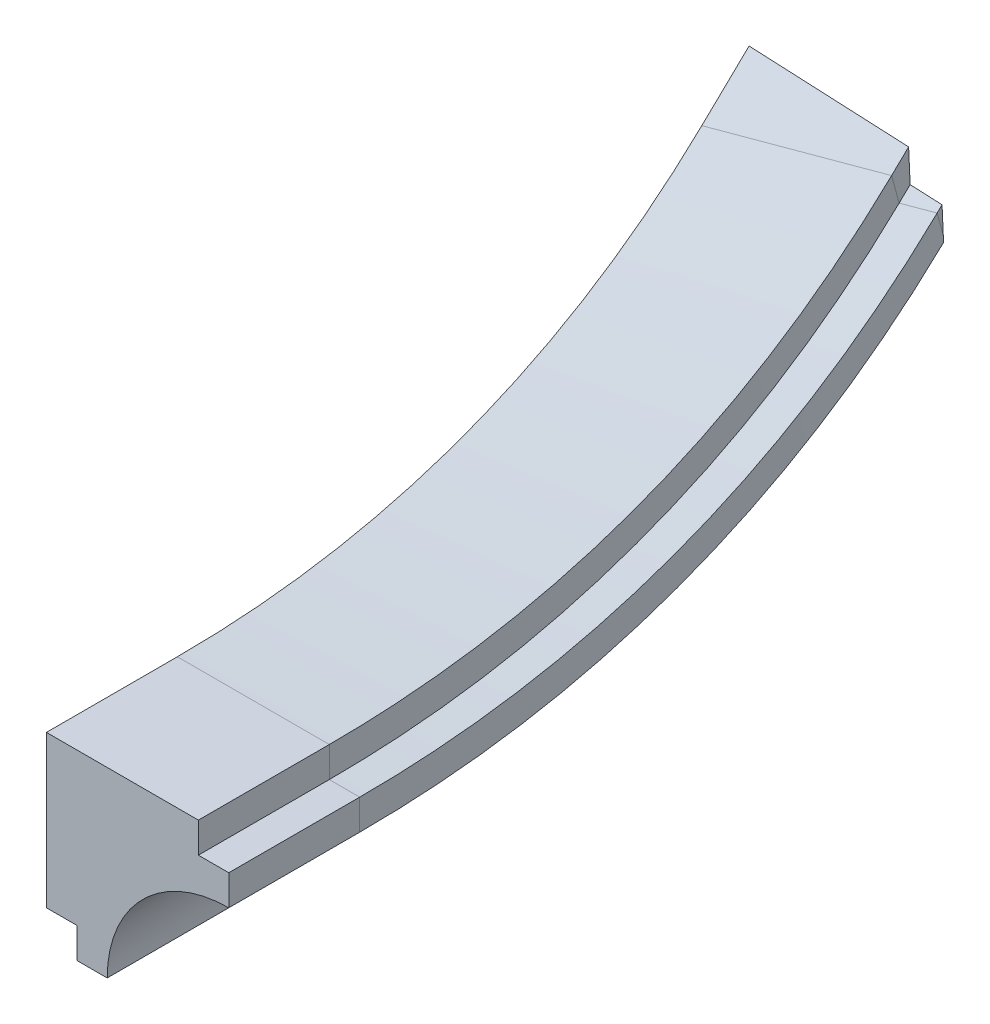
from build123d import *

# Parameters (mm, degrees)
BOSS_EXTRUDE1_DEPTH     = 21.542835
BOSS_EXTRUDE2_DEPTH     = 20
CUT_EXTRUDE1_DEPTH      = 302.548395788
CUT_EXTRUDE1_DEPTH_BACK = 302.548395788


with BuildPart() as part:
    # Sketch2 → Boss-Extrude1 (new body)
    with BuildSketch(Plane.XY):
        with BuildLine():
            Line((-130, 150), (-130, 155))
            Line((-130, 155), (-135, 155))
            Line((-135, 155), (-135, 160))
            Line((-135, 160), (-160, 160))
            Line((-160, 160), (-160, 135))
            Line((-160, 135), (-155, 135))
            Line((-155, 135), (-155, 130))
            Line((-155, 130), (-150, 130))
            ThreePointArc((-150, 130), (-144.142135624, 144.142135624), (-130, 150))
        make_face()
    extrude(amount=-BOSS_EXTRUDE1_DEPTH)

    # Sweep1: sweep along a path in Sketch4
    with BuildLine() as sweep1_path:  # in the path sketch's own coordinates; laid on its plane below (add() does not lay a ready-made edge on the line's plane)
        add(Edge.make_bspline(
            [(228.89342974, 133.442914197), (224.861563664, 124.645666682), (221.27410029, 115.681148912), (217.376072297, 104.254821774), (216.625831331, 101.958503692), (215.185057435, 97.343393816), (214.494025632, 95.02269737), (212.518715771, 88.050507511), (211.330281647, 83.383521366), (208.152076996, 69.325722792), (206.548808528, 59.878157687), (204.396699778, 40.828198756), (203.847763109, 31.225819083), (203.847763109, 21.542835377)],
            knots=[0, 0, 0, 0, 0.25, 0.25, 0.3125, 0.3125, 0.375, 0.375, 0.5, 0.5, 0.75, 0.75, 1, 1, 1, 1], degree=3))
    # Sketch3 → Sweep1 (sweep)
    with BuildSketch(Plane(origin=(0, 0, -21.542835377), x_dir=(-1, 0, 0), z_dir=(0, 0, -1))):
        with BuildLine():
            Line((150, 130), (155, 130))
            Line((155, 130), (155, 135))
            Line((155, 135), (160, 135))
            Line((160, 135), (160, 160))
            Line((160, 160), (135, 160))
            Line((135, 160), (135, 155))
            Line((135, 155), (130, 155))
            Line((130, 155), (130, 150))
            ThreePointArc((130, 150), (144.142135624, 144.142135624), (150, 130))
        make_face()
    sweep(path=Plane(origin=(0, 0, 0), x_dir=(-0.7071067811865475, 0.7071067811865477, 0), z_dir=(-0.7071067811865477, -0.7071067811865475, 0)) * sweep1_path.line)

    # Sketch5 → Boss-Extrude2 (add)
    with BuildSketch(Plane(origin=(-63.833913256, 63.833913256, -196.973218047), x_dir=(-0.9556185144061466, -0.0908241663548387, 0.28025742760922134), z_dir=(-0.29460694989118863, 0.29460694989118286, -0.9090728739499516))):
        with BuildLine():
            Line((109.09445388, 98.982255626), (114.08879222, 99.22013069))
            Line((114.08879222, 99.22013069), (113.850917156, 104.214469029))
            Line((113.850917156, 104.214469029), (118.845255496, 104.452344093))
            Line((118.845255496, 104.452344093), (117.655880177, 129.424035793))
            Line((117.655880177, 129.424035793), (92.684188477, 128.234660474))
            Line((92.684188477, 128.234660474), (92.922063541, 123.240322134))
            Line((92.922063541, 123.240322134), (87.927725201, 123.00244707))
            Line((87.927725201, 123.00244707), (88.165600265, 118.00810873))
            ThreePointArc((88.165600265, 118.00810873), (102.570410268, 112.829689684), (109.09445388, 98.982255626))
        make_face()
    extrude(amount=BOSS_EXTRUDE2_DEPTH)

    # Sketch6 → Cut-Extrude1 (cut, two sides: drawn at the far end of the back side and taken through both)
    with BuildSketch(Plane(origin=(0, 0, 0), x_dir=(1, 0, 0), z_dir=(0, 1, 0)).offset(-CUT_EXTRUDE1_DEPTH_BACK)):
        Polygon((-132.822725295, 135.609871351), (-210.486411616, 135.609871351), (-168.864707879, 181.580872781), align=None)
    extrude(amount=CUT_EXTRUDE1_DEPTH + CUT_EXTRUDE1_DEPTH_BACK, mode=Mode.SUBTRACT)


solid = part.part
